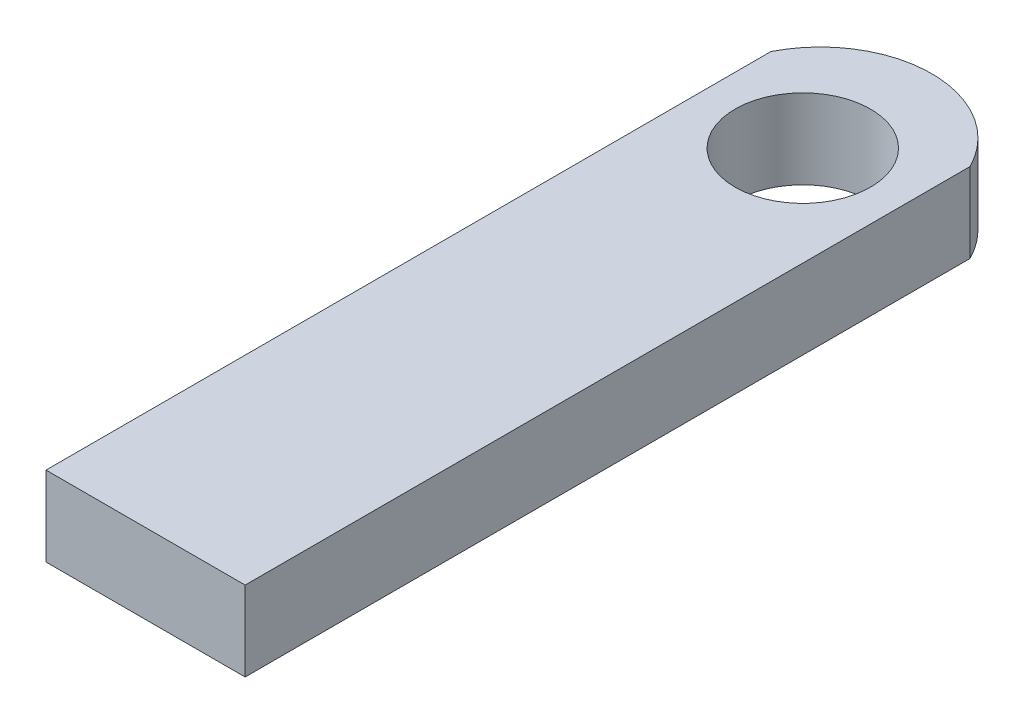
from build123d import *

# Parameters (mm, degrees)
SKETCH1_R           = 1.7
BOSS_EXTRUDE1_DEPTH = 2


with BuildPart() as part:
    # Sketch1 → Boss-Extrude1 (new body)
    with BuildSketch(Plane(origin=(0, 0, 0), x_dir=(1, 0, 0), z_dir=(0, 1, 0))):
        with BuildLine():
            Line((0, 0), (-5, 0))
            Line((-5, 0), (-5, 18.2))
            ThreePointArc((-5, 18.2), (-2.5, 19.739047979), (0, 18.2))
            Line((0, 18.2), (0, 0))
        make_face()
        with Locations(Location((-2.5, 16.5, 0), (0, 0, 270))):
            Circle(SKETCH1_R, mode=Mode.SUBTRACT)
    extrude(amount=BOSS_EXTRUDE1_DEPTH)


solid = part.part
